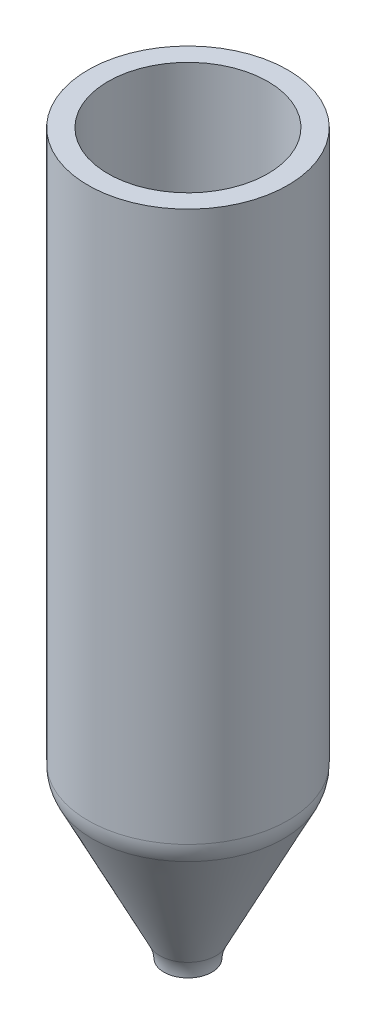
from build123d import *


with BuildPart() as part:
    # Sketch1 → Revolve1 (revolve)
    with BuildSketch(Plane.XY, mode=Mode.PRIVATE) as revolve1_sk:
        with BuildLine():
            Line((0.923731328, 2.372383803), (7.281644407, 2.372383803))
            ThreePointArc((7.281644407, 2.372383803), (7.667037893, 5.060184318), (8.614988038, 7.604627336))
            Line((8.614988038, 7.604627336), (30.062471525, 50.490436874))
            ThreePointArc((30.062471525, 50.490436874), (31.063868878, 53.252629767), (31.403731328, 56.171019692))
            Line((31.403731328, 56.171019692), (31.403731328, 230.972383803))
            Line((31.403731328, 230.972383803), (25.053731328, 230.972383803))
            Line((25.053731328, 230.972383803), (25.053731328, 57.670337636))
            ThreePointArc((25.053731328, 57.670337636), (24.713868878, 54.751947711), (23.712471525, 51.989754818))
            Line((23.712471525, 51.989754818), (2.264991132, 9.103951467))
            ThreePointArc((2.264991132, 9.103951467), (1.263593779, 6.341758574), (0.923731328, 3.423368649))
            Line((0.923731328, 3.423368649), (0.923731328, 2.372383803))
        make_face()
    revolve(revolve1_sk.sketch.rotate(Axis((-0.346268672, 2.373242664, 0), (0, 1, 0)), 90), axis=Axis((-0.346268672, 2.373242664, 0), (0, 1, 0)))


solid = part.part
